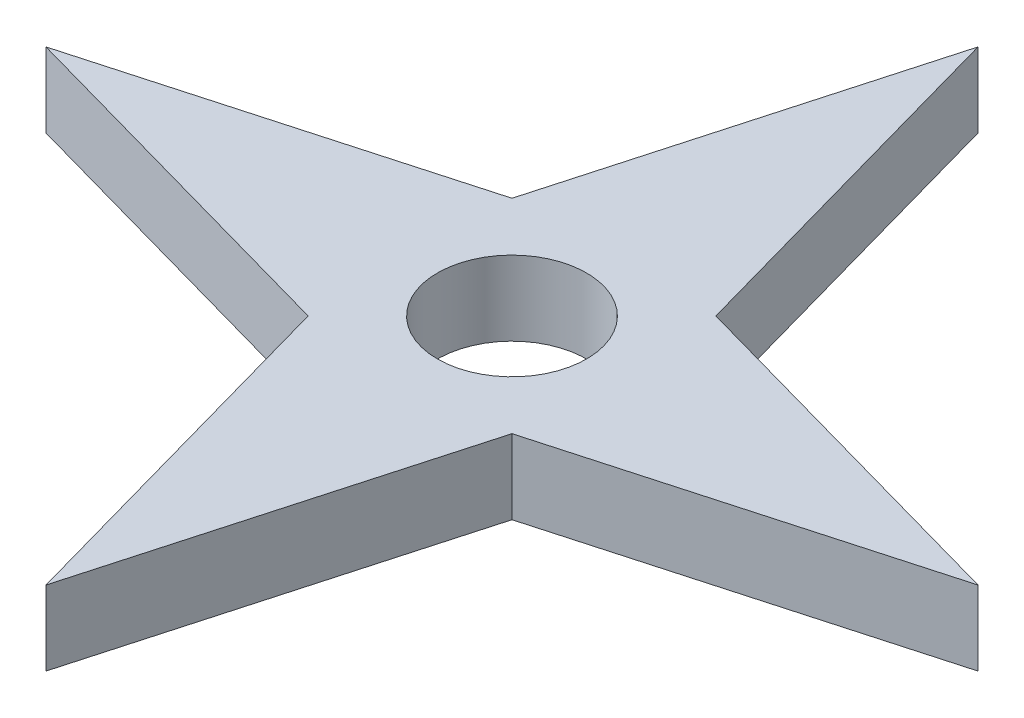
from build123d import *

# Parameters (mm, degrees)
SKETCH1_R           = 20
BOSS_EXTRUDE2_DEPTH = 20


with BuildPart() as part:
    # Sketch1 → Boss-Extrude2 (new body)
    with BuildSketch(Plane(origin=(0, 0, 0), x_dir=(1, 0, 0), z_dir=(0, 1, 0))):
        Polygon((125, 0), (27.34375, 27.34375), (0, 125), (-27.34375, 27.34375), (-125, 0), (-27.34375, -27.34375), (0, -125), (27.34375, -27.34375), align=None)
        with Locations(Location((0, 0, 0), (0, 0, 270))):
            Circle(SKETCH1_R, mode=Mode.SUBTRACT)
    extrude(amount=BOSS_EXTRUDE2_DEPTH)


solid = part.part
